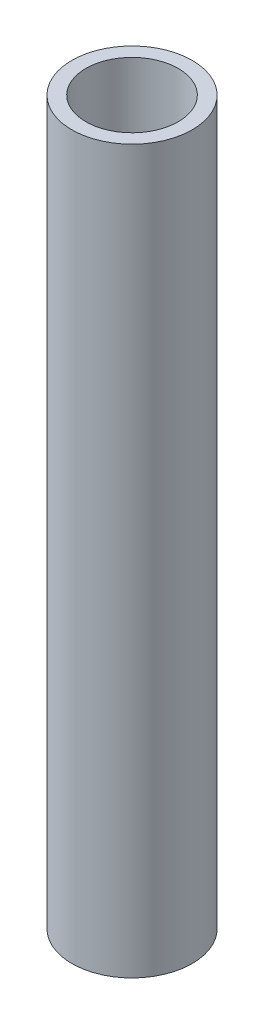
from build123d import *

# Parameters (mm, degrees)
SKETCH1_R           = 6.35
SKETCH1_R_2         = 4.8768
BOSS_EXTRUDE1_DEPTH = 76.2


with BuildPart() as part:
    # Sketch1 → Boss-Extrude1 (new body)
    with BuildSketch(Plane(origin=(0, 0, 0), x_dir=(1, 0, 0), z_dir=(0, 1, 0))):
        with Locations(Location((0, 0, 0), (0, 0, 90))):
            Circle(SKETCH1_R)
        with Locations(Location((0, 0, 0), (0, 0, 90))):
            Circle(SKETCH1_R_2, mode=Mode.SUBTRACT)
    extrude(amount=BOSS_EXTRUDE1_DEPTH)


solid = part.part
